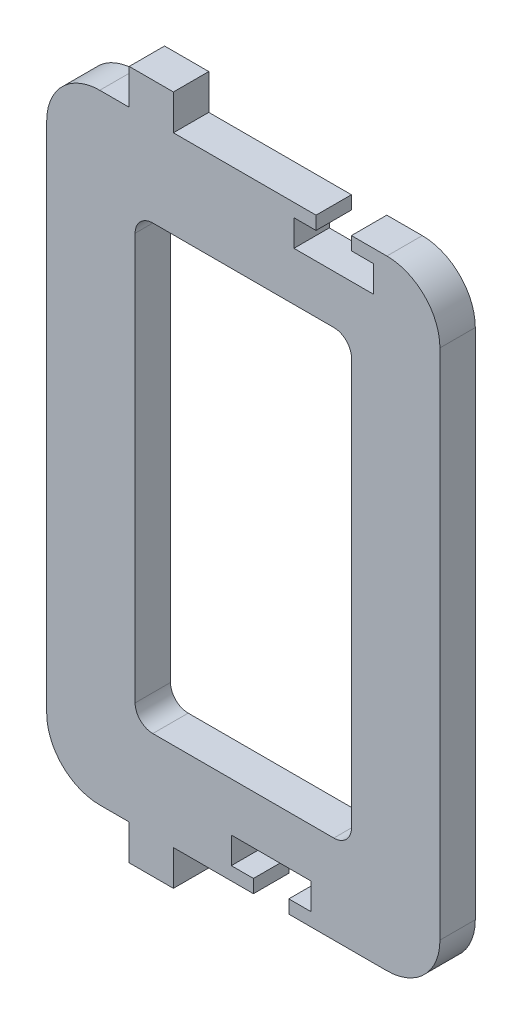
from build123d import *

# Parameters (mm, degrees)
SALIENTE_EXTRUIR1_DEPTH = 4


with BuildPart() as part:
    # Croquis1 → Saliente-Extruir1 (new body)
    with BuildSketch(Plane.XY):
        with BuildLine():
            Line((-48.365211809, -20.854133368), (-51.695211809, -20.854133368))
            ThreePointArc((-51.695211809, -20.854133368), (-55.937852496, -19.096774055), (-57.695211809, -14.854133368))
            Line((-57.695211809, -14.854133368), (-57.695211809, 43.145866632))
            ThreePointArc((-57.695211809, 43.145866632), (-55.937852496, 47.388507319), (-51.695211809, 49.145866632))
            Line((-51.695211809, 49.145866632), (-48.365211809, 49.145866632))
            Line((-48.365211809, 49.145866632), (-48.365211809, 53.145866632))
            Line((-48.365211809, 53.145866632), (-43.365211809, 53.145866632))
            Line((-43.365211809, 53.145866632), (-43.365211809, 49.145866632))
            Line((-43.365211809, 49.145866632), (-27.235211809, 49.145866632))
            Line((-27.235211809, 49.145866632), (-27.235211809, 47.645866632))
            Line((-27.235211809, 47.645866632), (-29.735211809, 47.645866632))
            Line((-29.735211809, 47.645866632), (-29.735211809, 44.645866632))
            Line((-29.735211809, 44.645866632), (-20.735211809, 44.645866632))
            Line((-20.735211809, 44.645866632), (-20.735211809, 47.645866632))
            Line((-20.735211809, 47.645866632), (-23.235211809, 47.645866632))
            Line((-23.235211809, 47.645866632), (-23.235211809, 49.145866632))
            Line((-23.235211809, 49.145866632), (-19.225211809, 49.145866632))
            ThreePointArc((-19.225211809, 49.145866632), (-14.982571122, 47.388507319), (-13.225211809, 43.145866632))
            Line((-13.225211809, 43.145866632), (-13.225211809, -14.854133368))
            ThreePointArc((-13.225211809, -14.854133368), (-14.982571122, -19.096774055), (-19.225211809, -20.854133368))
            Line((-19.225211809, -20.854133368), (-30.315211809, -20.854133368))
            Line((-30.315211809, -20.854133368), (-30.315211809, -19.354133368))
            Line((-30.315211809, -19.354133368), (-27.815211809, -19.354133368))
            Line((-27.815211809, -19.354133368), (-27.815211809, -16.354133368))
            Line((-27.815211809, -16.354133368), (-36.815211809, -16.354133368))
            Line((-36.815211809, -16.354133368), (-36.815211809, -19.354133368))
            Line((-36.815211809, -19.354133368), (-34.315211809, -19.354133368))
            Line((-34.315211809, -19.354133368), (-34.315211809, -20.854133368))
            Line((-34.315211809, -20.854133368), (-43.365211809, -20.854133368))
            Line((-43.365211809, -20.854133368), (-43.365211809, -24.854133368))
            Line((-43.365211809, -24.854133368), (-48.365211809, -24.854133368))
            Line((-48.365211809, -24.854133368), (-48.365211809, -20.854133368))
        make_face()
        with BuildLine():
            Line((-47.695211809, 14.145866632), (-47.695211809, -8.854133368))
            ThreePointArc((-47.695211809, -8.854133368), (-47.109425371, -10.26834693), (-45.695211809, -10.854133368))
            Line((-45.695211809, -10.854133368), (-25.225211809, -10.854133368))
            ThreePointArc((-25.225211809, -10.854133368), (-23.810998246, -10.26834693), (-23.225211809, -8.854133368))
            Line((-23.225211809, -8.854133368), (-23.225211809, 37.145866632))
            ThreePointArc((-23.225211809, 37.145866632), (-23.810998246, 38.560080194), (-25.225211809, 39.145866632))
            Line((-25.225211809, 39.145866632), (-45.695211809, 39.145866632))
            ThreePointArc((-45.695211809, 39.145866632), (-47.109425371, 38.560080194), (-47.695211809, 37.145866632))
            Line((-47.695211809, 37.145866632), (-47.695211809, 14.145866632))
        make_face(mode=Mode.SUBTRACT)
    extrude(amount=SALIENTE_EXTRUIR1_DEPTH)


solid = part.part
